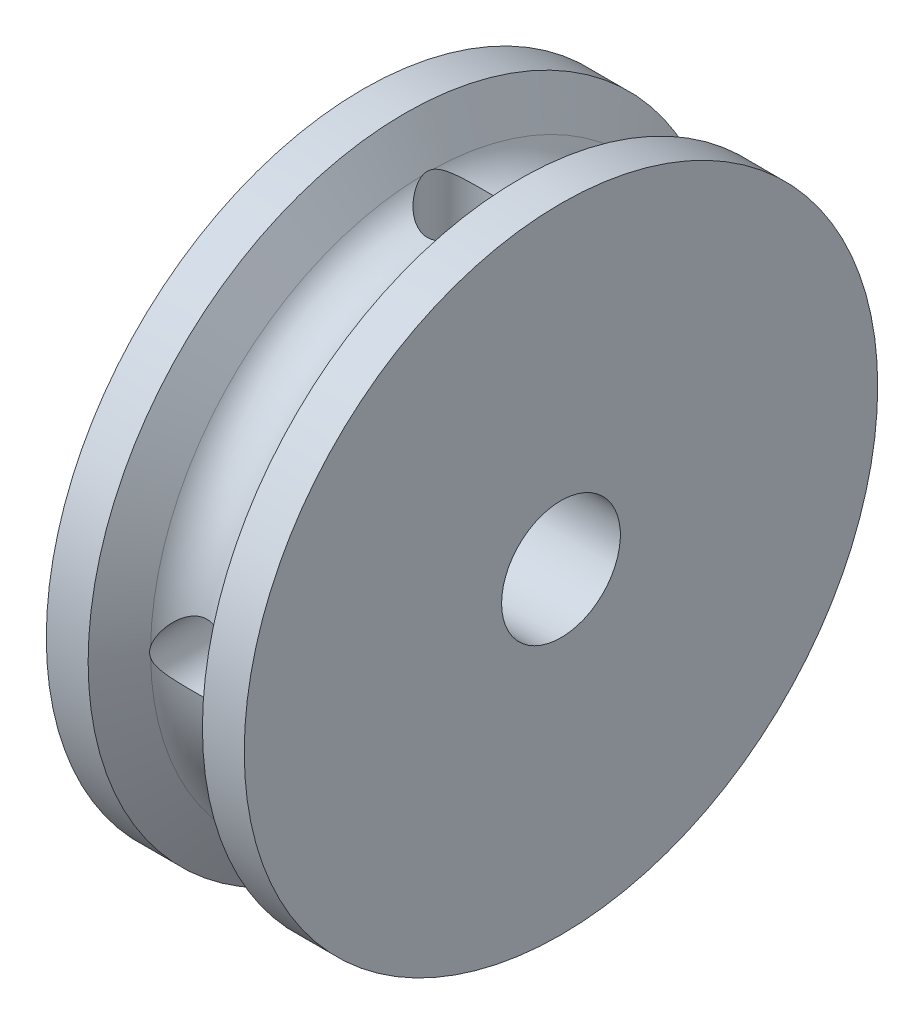
from build123d import *

# Parameters (mm, degrees)
CUT_EXTRUDE_START        = -5
SKETCH_2_R               = 1.75
CUT_EXTRUDE_1_DEPTH      = 39.496268449
SKETCH_4_W               = 1.25
SKETCH_4_H               = 8
PATTERN_CIRCULAR_1_COUNT = 2
PATTERN_CIRCULAR_1_ANGLE = 90


with BuildPart() as part:
    # ｽｹｯﾁ1 → 回転1 (revolve)
    with BuildSketch(Plane.XY, mode=Mode.PRIVATE) as revolve_1_sk:
        with BuildLine():
            Line((5, 16), (5, 3))
            Line((5, 3), (-5, 3))
            Line((-5, 3), (-5, 16))
            Line((-5, 16), (-2.886751346, 16))
            Line((-2.886751346, 16), (-1.732050808, 14))
            ThreePointArc((-1.732050808, 14), (0, 13), (1.732050808, 14))
            Line((1.732050808, 14), (2.886751346, 16))
            Line((2.886751346, 16), (5, 16))
        make_face()
    revolve(revolve_1_sk.sketch.rotate(Axis((-76.157807816, 0, 0), (1, 0, 0)), 90), axis=Axis((-76.157807816, 0, 0), (1, 0, 0)))

    # ｽｹｯﾁ2 → ｶｯﾄ - 押し出し1 (cut)
    with BuildSketch(Plane(origin=(0, 13, 0), x_dir=(1, 0, 0), z_dir=(0, 1, 0)).offset(CUT_EXTRUDE_START)):
        with Locations(Location((0, 0, 0), (0, 0, 171.786783431))):
            Circle(SKETCH_2_R)
    cut_extrude_1 = extrude(amount=CUT_EXTRUDE_1_DEPTH, mode=Mode.SUBTRACT)

    # ｽｹｯﾁ4 → M3x0.5 ねじ穴1 (revolve, cut)
    with BuildSketch(Plane(origin=(0, 8, 0), x_dir=(0, 0, 1), z_dir=(1, 0, 0))):
        with Locations((0.625, 4)):
            Rectangle(SKETCH_4_W, SKETCH_4_H)
    m3x0_5_1 = revolve(axis=Axis((0, 14.35, 0), (0, -1, 0)), mode=Mode.SUBTRACT)

    # 円形ﾊﾟﾀｰﾝ1: ｶｯﾄ - 押し出し1, M3x0.5 ねじ穴1 ×2 about axis
    pattern_circular_1_axis = Axis((-88.99, 0, 0), (1, 0, 0))
    add([cut_extrude_1.rotate(pattern_circular_1_axis, i * PATTERN_CIRCULAR_1_ANGLE / (PATTERN_CIRCULAR_1_COUNT - 1)) for i in range(1, PATTERN_CIRCULAR_1_COUNT)], mode=Mode.SUBTRACT)
    add([m3x0_5_1.rotate(pattern_circular_1_axis, i * PATTERN_CIRCULAR_1_ANGLE / (PATTERN_CIRCULAR_1_COUNT - 1)) for i in range(1, PATTERN_CIRCULAR_1_COUNT)], mode=Mode.SUBTRACT)


solid = part.part
